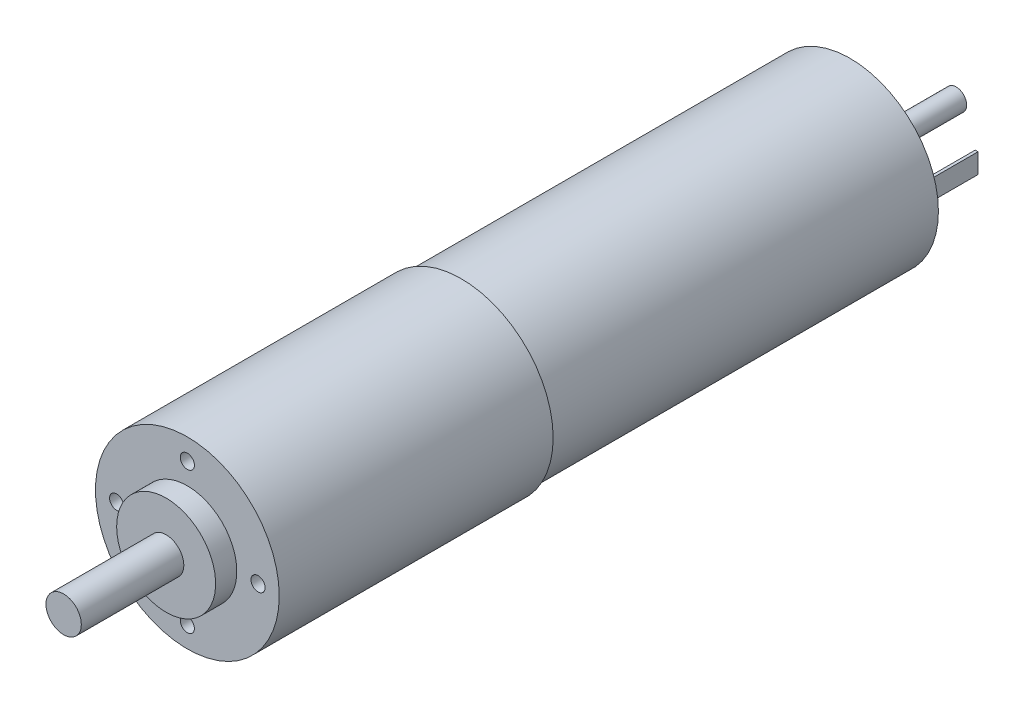
from build123d import *

# Parameters (mm, degrees)
SKETCH1_R        = 12.5
EXTRUSION1_DEPTH = 55
SKETCH2_R        = 13
EXTRUSION2_DEPTH = 38.75
SKETCH3_R        = 7
EXTRUSION3_DEPTH = 3
SKETCH4_R        = 2.5
EXTRUSION4_DEPTH = 14.5
SKETCH5_R        = 1
EXTRUSION5_DEPTH = 4
SKETCH6_R        = 4
EXTRUSION6_DEPTH = 2.75
SKETCH7_R        = 1.5
EXTRUSION7_DEPTH = 15
SKETCH8_W        = 0.4
SKETCH8_H        = 2.8
EXTRUSION8_DEPTH = 8.7


with BuildPart() as part:
    # Sketch1 → Extrusion1 (new body)
    with BuildSketch(Plane.XY):
        Circle(SKETCH1_R)
    extrude(amount=EXTRUSION1_DEPTH)

    # Sketch2 → Extrusion2 (add)
    with BuildSketch(Plane.XY.offset(55)):
        Circle(SKETCH2_R)
    extrude(amount=EXTRUSION2_DEPTH)

    # Sketch3 → Extrusion3 (add)
    with BuildSketch(Plane.XY.offset(93.75)):
        with Locations(Location((0, 0, 0), (0, 0, 180))):
            Circle(SKETCH3_R)
    extrude(amount=EXTRUSION3_DEPTH)

    # Sketch4 → Extrusion4 (add)
    with BuildSketch(Plane.XY.offset(96.75)):
        Circle(SKETCH4_R)
    extrude(amount=EXTRUSION4_DEPTH)

    # Sketch5 → Extrusion5 (cut)
    with BuildSketch(Plane.XY.offset(93.75)):
        with Locations((0, 10)):
            Circle(SKETCH5_R)
        with Locations((10, 0)):
            Circle(SKETCH5_R)
        with Locations((0, -10)):
            Circle(SKETCH5_R)
        with Locations((-10, 0)):
            Circle(SKETCH5_R)
    extrude(amount=-EXTRUSION5_DEPTH, mode=Mode.SUBTRACT)

    # Sketch6 → Extrusion6 (add)
    with BuildSketch(Plane(origin=(0, 0, 0), x_dir=(-1, 0, 0), z_dir=(0, 0, -1))):
        Circle(SKETCH6_R)
    extrude(amount=EXTRUSION6_DEPTH)

    # Sketch7 → Extrusion7 (add)
    with BuildSketch(Plane(origin=(0, 0, 0), x_dir=(-1, 0, 0), z_dir=(0, 0, -1))):
        Circle(SKETCH7_R)
    extrude(amount=EXTRUSION7_DEPTH)

    # Sketch8 → Extrusion8 (add)
    with BuildSketch(Plane(origin=(0, 0, 0), x_dir=(-1, 0, 0), z_dir=(0, 0, -1))):
        with Locations((9.2, 0)):
            Rectangle(SKETCH8_W, SKETCH8_H)
        with Locations((-9.2, 0)):
            Rectangle(SKETCH8_W, SKETCH8_H)
    extrude(amount=EXTRUSION8_DEPTH)


solid = part.part
